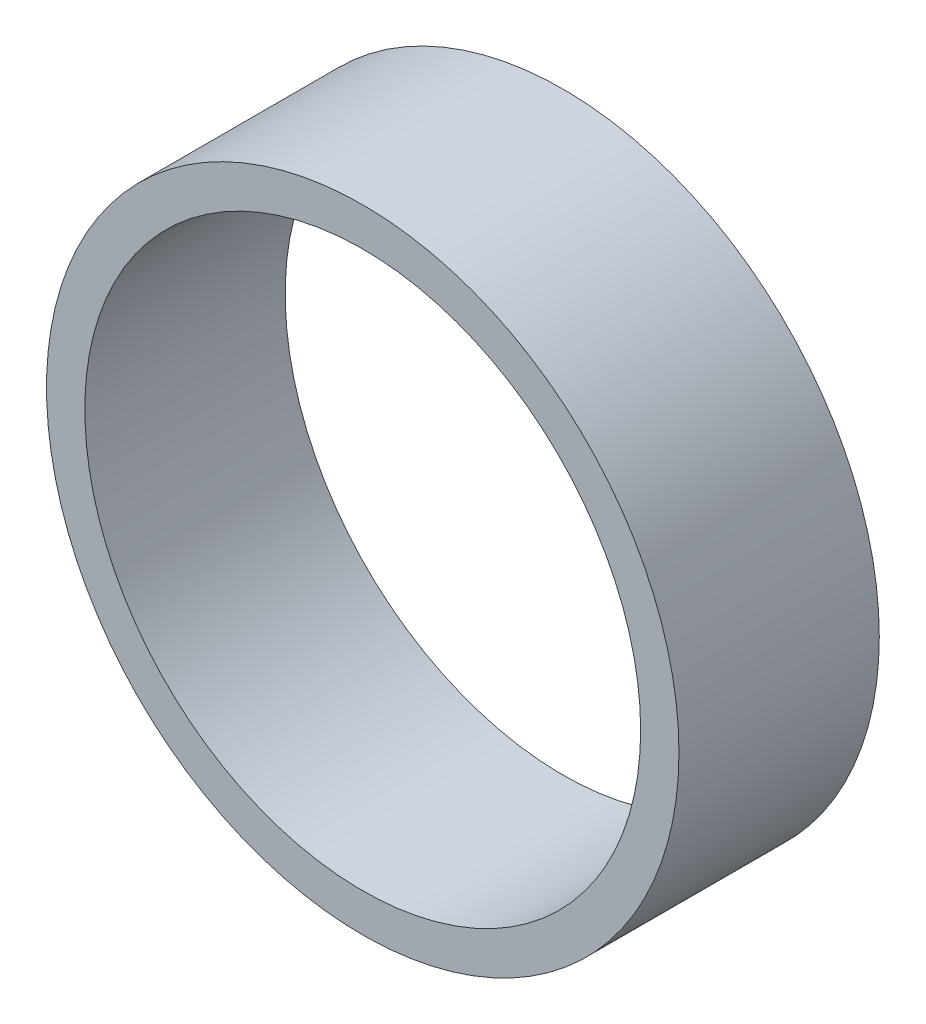
from build123d import *

# Parameters (mm, degrees)
SKETCH1_R           = 10.985
SKETCH1_R_2         = 3.965
BOSS_EXTRUDE1_DEPTH = 6.96
CUT_EXTRUDE1_START  = -6.96
SKETCH2_R           = 9.655
SKETCH2_R_2         = 3.965
CUT_EXTRUDE1_DEPTH  = 6.96


with BuildPart() as part:
    # Sketch1 → Boss-Extrude1 (new body)
    with BuildSketch(Plane.XY):
        with Locations((10.764645842, -2.189206451)):
            Circle(SKETCH1_R)
        with Locations((10.764645842, -2.189206451)):
            Circle(SKETCH1_R_2, mode=Mode.SUBTRACT)
    extrude(amount=BOSS_EXTRUDE1_DEPTH)

    # Sketch2 → Cut-Extrude1 (cut)
    with BuildSketch(Plane.XY.offset(6.96).offset(CUT_EXTRUDE1_START)):
        with Locations((10.764645842, -2.189206451)):
            Circle(SKETCH2_R)
        with Locations((10.764645842, -2.189206451)):
            Circle(SKETCH2_R_2, mode=Mode.SUBTRACT)
    extrude(amount=CUT_EXTRUDE1_DEPTH, mode=Mode.SUBTRACT)


solid = part.part
